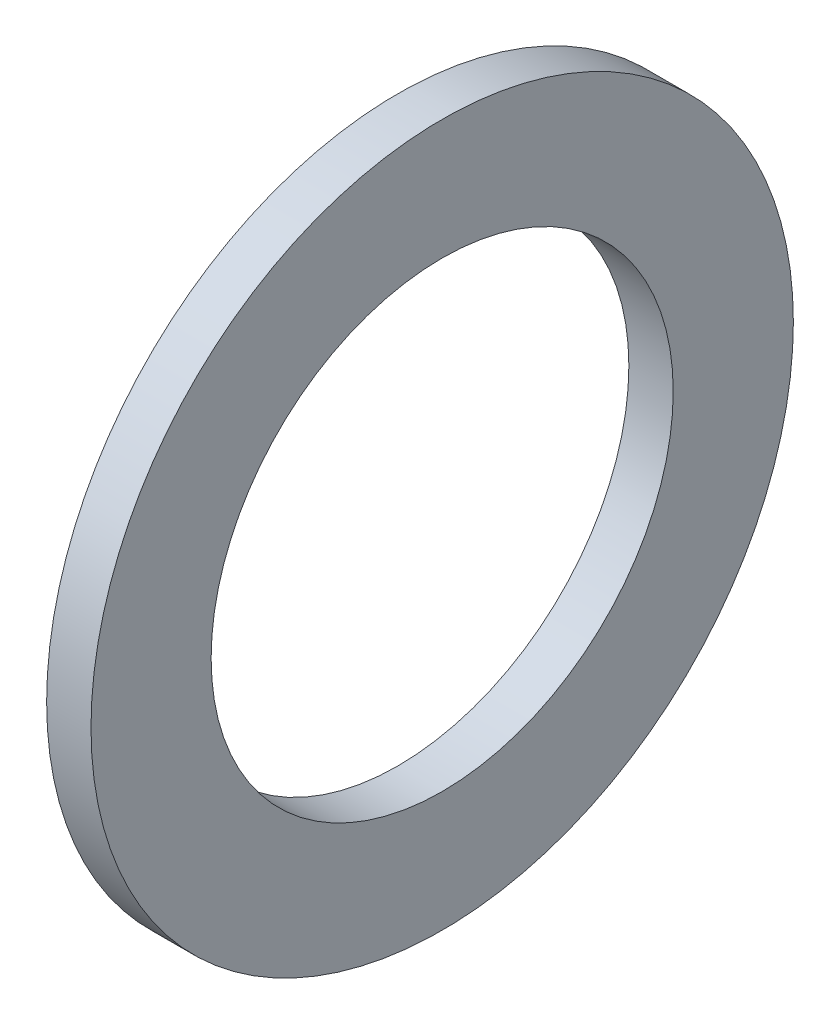
from build123d import *

# Parameters (mm, degrees)
SKETCH1_R           = 7.239
SKETCH1_R_2         = 4.7625
BOSS_EXTRUDE1_DEPTH = 0.9144


with BuildPart() as part:
    # Sketch1 → Boss-Extrude1 (new body)
    with BuildSketch(Plane(origin=(0, 0, 0), x_dir=(0, 0, -1), z_dir=(1, 0, 0))):
        Circle(SKETCH1_R)
        Circle(SKETCH1_R_2, mode=Mode.SUBTRACT)
    extrude(amount=BOSS_EXTRUDE1_DEPTH)


solid = part.part
